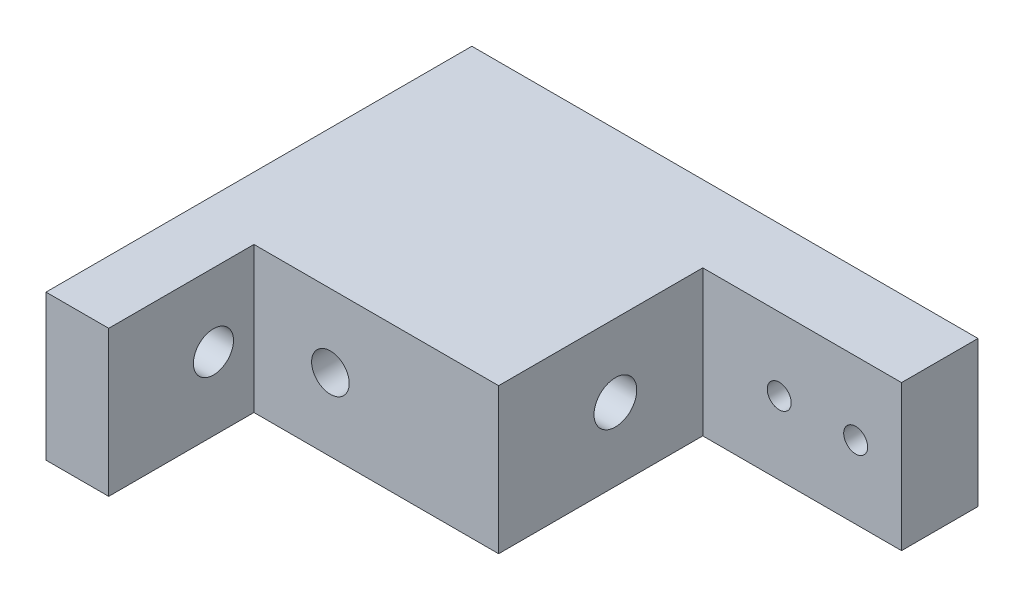
from build123d import *

# Parameters (mm, degrees)
SKETCH1_W                    = 33.1
SKETCH1_H                    = 27.85
BOSS_EXTRUDE1_DEPTH          = 9.52
SKETCH2_W                    = 13
SKETCH2_H                    = 22.849999999
CUT_EXTRUDE1_DEPTH           = 38.725494033
SKETCH3_W                    = 16
SKETCH3_H                    = 9.5
CUT_EXTRUDE2_DEPTH           = 38.725494033
F_97_0_0059_DIAMETER_HOLE1_D = 2.794


with BuildPart() as part:
    # Sketch1 → Boss-Extrude1 (new body)
    with BuildSketch(Plane.XZ.offset(4.76)):
        with Locations((-7.05, 13.925)):
            Rectangle(SKETCH1_W, SKETCH1_H)
    extrude(amount=-BOSS_EXTRUDE1_DEPTH)

    # Sketch2 → Cut-Extrude1 (cut, through all)
    with BuildSketch(Plane(origin=(0, 4.76, 0), x_dir=(-1, 0, 0), z_dir=(0, 1, 0))):
        with Locations((-3, 16.425)):
            Rectangle(SKETCH2_W, SKETCH2_H)
    extrude(amount=-CUT_EXTRUDE1_DEPTH, mode=Mode.SUBTRACT)

    # Sketch3 → Cut-Extrude2 (cut, through all)
    with BuildSketch(Plane(origin=(0, 4.76, 0), x_dir=(-1, 0, 0), z_dir=(0, 1, 0))):
        with Locations((11.5, 23.1)):
            Rectangle(SKETCH3_W, SKETCH3_H)
    extrude(amount=-CUT_EXTRUDE2_DEPTH, mode=Mode.SUBTRACT)

    # Sketch4 → Cut-Revolve1 (revolve, cut)
    with BuildSketch(Plane(origin=(0, 0, 0), x_dir=(1, 0, 0), z_dir=(0, 1, 0))):
        Polygon((7.2835, 0), (6.5, 0), (6.5, -5.000000001), (7.2835, -5.000000001), (7.2835, -2), align=None)
    revolve(axis=Axis((6.5, 0, 0), (0, 0, 1)), mode=Mode.SUBTRACT)

    # Sketch5 → Cut-Revolve2 (revolve, cut)
    with BuildSketch(Plane(origin=(0, 0, 0), x_dir=(1, 0, 0), z_dir=(0, 1, 0))):
        Polygon((2.2835, 0), (1.5, 0), (1.5, -5.000000001), (2.2835, -5.000000001), (2.2835, -2), align=None)
    revolve(axis=Axis((1.5, 0, 0), (0, 0, 1)), mode=Mode.SUBTRACT)

    # Sketch6 → Cut-Revolve3 (revolve, cut)
    with BuildSketch(Plane.XZ, mode=Mode.PRIVATE) as cut_revolve3_sk:
        Polygon((-13.2705, 18.35), (-14.5, 18.35), (-14.5, 8.35), (-13.2705, 8.35), (-13.2705, 16.35), align=None)
    revolve(cut_revolve3_sk.sketch.rotate(Axis((-14.5, 0, 18.35), (0, 0, -1)), 180), axis=Axis((-14.5, 0, 18.35), (0, 0, -1)), mode=Mode.SUBTRACT)

    # Sketch7 → Cut-Revolve4 (revolve, cut)
    with BuildSketch(Plane.XY.offset(21)):
        Polygon((-23.6, 1.3105), (-23.6, 0), (-19.5, 0), (-19.5, 1.3105), (-21.6, 1.3105), align=None)
    revolve(axis=Axis((-23.6, 0, 21), (1, 0, 0)), mode=Mode.SUBTRACT)

    # #97 (0.0059) Diameter Hole1 (through all)
    with Locations(Plane.ZY.offset(23.6)):
        with Locations((10.71372, 0)):
            Hole(F_97_0_0059_DIAMETER_HOLE1_D / 2)


solid = part.part
